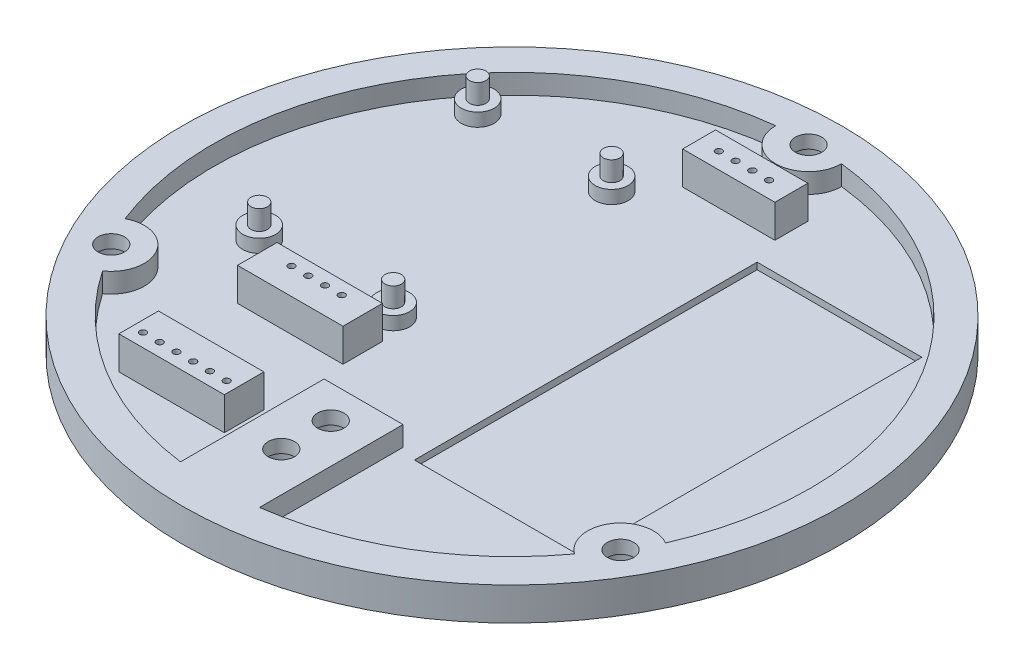
from build123d import *

# Parameters (mm, degrees)
SKIZZE2_R                        = 50
SKIZZE2_R_2                      = 2
AUFSATZ_LINEAR_AUSTRAGEN1_DEPTH  = 5
SCHNITT_LINEAR_AUSTRAGEN2_DEPTH  = 3
SKIZZE10_R                       = 3.5
SCHNITT_LINEAR_AUSTRAGEN3_DEPTH  = 3
SCHNITT_LINEAR_AUSTRAGEN7_DEPTH  = 3
SKIZZE27_W                       = 25
SKIZZE27_H                       = 52
SCHNITT_LINEAR_AUSTRAGEN10_DEPTH = 1
SKIZZE12_R                       = 2.5
AUFSATZ_LINEAR_AUSTRAGEN5_DEPTH  = 2
SKIZZE30_R                       = 1.25
AUFSATZ_LINEAR_AUSTRAGEN6_DEPTH  = 3
SKIZZE31_W                       = 16
SKIZZE31_H                       = 6
AUFSATZ_LINEAR_AUSTRAGEN8_DEPTH  = 5
SKIZZE32_R                       = 0.5
SCHNITT_LINEAR_AUSTRAGEN11_DEPTH = 6.5
SKIZZE35_W                       = 14
SKIZZE35_H                       = 5
AUFSATZ_LINEAR_AUSTRAGEN9_DEPTH  = 5
SKIZZE36_R                       = 0.5
SCHNITT_LINEAR_AUSTRAGEN12_DEPTH = 6.5


with BuildPart() as part:
    # Skizze2 → Aufsatz-Linear austragen1 (new body)
    with BuildSketch(Plane(origin=(0, 0, 0), x_dir=(1, 0, 0), z_dir=(0, 1, 0))):
        with Locations(Location((0, 0, 0), (0, 0, 270))):
            Circle(SKIZZE2_R)
        with Locations(Location((38.97114317, -22.5, 0), (0, 0, 270))):
            Circle(SKIZZE2_R_2, mode=Mode.SUBTRACT)
        with Locations(Location((-39.80150929, -20.996186754, 0), (0, 0, 270))):
            Circle(SKIZZE2_R_2, mode=Mode.SUBTRACT)
        with Locations(Location((0, 45, 0), (0, 0, 270))):
            Circle(SKIZZE2_R_2, mode=Mode.SUBTRACT)
        with Locations(Location((0, -35, 0), (0, 0, 270))):
            Circle(SKIZZE2_R_2, mode=Mode.SUBTRACT)
        with Locations(Location((0, -27.5, 0), (0, 0, 270))):
            Circle(SKIZZE2_R_2, mode=Mode.SUBTRACT)
    extrude(amount=AUFSATZ_LINEAR_AUSTRAGEN1_DEPTH)

    # Skizze9 → Schnitt-Linear austragen2 (cut)
    with BuildSketch(Plane(origin=(0, 5, 0), x_dir=(1, 0, 0), z_dir=(0, 1, 0))):
        with BuildLine():
            Line((-6, -39.531216002), (-6, -22.531216002))
            Line((-6, -22.531216002), (6, -22.531216002))
            Line((6, -22.531216002), (6, -39.531216002))
            ThreePointArc((6, -39.531216002), (0, 39.983959767), (-6, -39.531216002))
        make_face()
    extrude(amount=-SCHNITT_LINEAR_AUSTRAGEN2_DEPTH, mode=Mode.SUBTRACT)

    # Skizze10 → Schnitt-Linear austragen3 (cut)
    with BuildSketch(Plane.XZ):
        with Locations(Location((0, 27.5, 0), (0, 0, 270))):
            Circle(SKIZZE10_R)
        with Locations(Location((0, 35, 0), (0, 0, 270))):
            Circle(SKIZZE10_R)
        with Locations(Location((38.97114317, 22.5, 0), (0, 0, 270))):
            Circle(SKIZZE10_R)
        with Locations(Location((-39.80150929, 20.996186754, 0), (0, 0, 270))):
            Circle(SKIZZE10_R)
        with Locations(Location((0, -45, 0), (0, 0, 270))):
            Circle(SKIZZE10_R)
    extrude(amount=-SCHNITT_LINEAR_AUSTRAGEN3_DEPTH, mode=Mode.SUBTRACT)

    # Skizze11 → Schnitt-Linear austragen7 (cut)
    with BuildSketch(Plane(origin=(0, 5, 0), x_dir=(1, 0, 0), z_dir=(0, 1, 0))):
        with BuildLine():
            Line((-5.978957813, -44.319844294), (-5.978957813, -22.5))
            Line((-5.978957813, -22.5), (6, -22.531216002))
            Line((6, -22.531216002), (6, -44.317000516))
            ThreePointArc((6, -44.317000516), (22.808968791, -38.467485978), (36.005466779, -26.525514072))
            ThreePointArc((36.005466779, -26.525514072), (34.786839389, -19.762920925), (41.47114317, -18.169872981))
            ThreePointArc((41.47114317, -18.169872981), (39.210967853, 22.638462845), (5, 45))
            ThreePointArc((5, 45), (0, 40), (-5, 45))
            ThreePointArc((-5, 45), (-38.771722635, 23.382761255), (-42.13441893, -16.573796833))
            ThreePointArc((-42.13441893, -16.573796833), (-35.515787713, -18.42080512), (-36.991636347, -25.131959239))
            ThreePointArc((-36.991636347, -25.131959239), (-23.530017506, -38.030708788), (-5.978957813, -44.319844294))
        make_face()
    extrude(amount=-SCHNITT_LINEAR_AUSTRAGEN7_DEPTH, mode=Mode.SUBTRACT)

    # Skizze27 → Schnitt-Linear austragen10 (cut)
    with BuildSketch(Plane.XZ.offset(-2)):
        with Locations((21.020025154, -2.667993815)):
            Rectangle(SKIZZE27_W, SKIZZE27_H)
    extrude(amount=SCHNITT_LINEAR_AUSTRAGEN10_DEPTH, mode=Mode.SUBTRACT)

    # Skizze12 → Aufsatz-Linear austragen5 (add)
    with BuildSketch(Plane(origin=(0, 2, 0), x_dir=(1, 0, 0), z_dir=(0, 1, 0))):
        with Locations(Location((-32.155741969, 26.956104286, 0), (0, 0, 90))):
            Circle(SKIZZE12_R)
        with Locations(Location((-11.835741969, 26.956104286, 0), (0, 0, 90))):
            Circle(SKIZZE12_R)
        with Locations(Location((-32.155741969, -6.193895714, 0), (0, 0, 90))):
            Circle(SKIZZE12_R)
        with Locations(Location((-11.835741969, -6.193895714, 0), (0, 0, 90))):
            Circle(SKIZZE12_R)
    extrude(amount=AUFSATZ_LINEAR_AUSTRAGEN5_DEPTH)

    # Skizze30 → Aufsatz-Linear austragen6 (add)
    with BuildSketch(Plane(origin=(0, 4, 0), x_dir=(1, 0, 0), z_dir=(0, 1, 0))):
        with Locations(Location((-32.155741969, 26.956104286, 0), (0, 0, 270))):
            Circle(SKIZZE30_R)
        with Locations(Location((-11.835741969, 26.956104286, 0), (0, 0, 270))):
            Circle(SKIZZE30_R)
        with Locations(Location((-32.155741969, -6.193895714, 0), (0, 0, 270))):
            Circle(SKIZZE30_R)
        with Locations(Location((-11.835741969, -6.193895714, 0), (0, 0, 270))):
            Circle(SKIZZE30_R)
    extrude(amount=AUFSATZ_LINEAR_AUSTRAGEN6_DEPTH)

    # Skizze31 → Aufsatz-Linear austragen8 (add)
    with BuildSketch(Plane(origin=(0, 2, 0), x_dir=(1, 0, 0), z_dir=(0, 1, 0))):
        with Locations((-17.477480193, -13.166385762)):
            Rectangle(SKIZZE31_W, SKIZZE31_H)
        with Locations((-17.477480193, -31.166385762)):
            Rectangle(SKIZZE31_W, SKIZZE31_H)
    extrude(amount=AUFSATZ_LINEAR_AUSTRAGEN8_DEPTH)

    # Skizze32 → Schnitt-Linear austragen11 (cut)
    with BuildSketch(Plane(origin=(0, 7, 0), x_dir=(1, 0, 0), z_dir=(0, 1, 0))):
        with Locations(Location((-16.207480193, -12.166385762, 0), (0, 0, 270))):
            Circle(SKIZZE32_R)
        with Locations(Location((-13.667480193, -12.166385762, 0), (0, 0, 270))):
            Circle(SKIZZE32_R)
        with Locations(Location((-18.747480193, -12.166385762, 0), (0, 0, 270))):
            Circle(SKIZZE32_R)
        with Locations(Location((-21.287480193, -12.166385762, 0), (0, 0, 270))):
            Circle(SKIZZE32_R)
        with Locations(Location((-16.207480193, -32.166385762, 0), (0, 0, 270))):
            Circle(SKIZZE32_R)
        with Locations(Location((-13.667480193, -32.166385762, 0), (0, 0, 270))):
            Circle(SKIZZE32_R)
        with Locations(Location((-11.127480193, -32.166385762, 0), (0, 0, 270))):
            Circle(SKIZZE32_R)
        with Locations(Location((-18.747480193, -32.166385762, 0), (0, 0, 270))):
            Circle(SKIZZE32_R)
        with Locations(Location((-21.287480193, -32.166385762, 0), (0, 0, 270))):
            Circle(SKIZZE32_R)
        with Locations(Location((-23.827480193, -32.166385762, 0), (0, 0, 270))):
            Circle(SKIZZE32_R)
    extrude(amount=-SCHNITT_LINEAR_AUSTRAGEN11_DEPTH, mode=Mode.SUBTRACT)

    # Skizze35 → Aufsatz-Linear austragen9 (add)
    with BuildSketch(Plane(origin=(0, 2, 0), x_dir=(1, 0, 0), z_dir=(0, 1, 0))):
        with Locations((0, 35.385800952)):
            Rectangle(SKIZZE35_W, SKIZZE35_H)
    extrude(amount=AUFSATZ_LINEAR_AUSTRAGEN9_DEPTH)

    # Skizze36 → Schnitt-Linear austragen12 (cut)
    with BuildSketch(Plane(origin=(0, 7, 0), x_dir=(1, 0, 0), z_dir=(0, 1, 0))):
        with Locations(Location((1.118435078, 35.339246481, 0), (0, 0, 270))):
            Circle(SKIZZE36_R)
        with Locations(Location((3.658435078, 35.339246481, 0), (0, 0, 270))):
            Circle(SKIZZE36_R)
        with Locations(Location((-1.421564922, 35.339246481, 0), (0, 0, 270))):
            Circle(SKIZZE36_R)
        with Locations(Location((-3.961564922, 35.339246481, 0), (0, 0, 270))):
            Circle(SKIZZE36_R)
    extrude(amount=-SCHNITT_LINEAR_AUSTRAGEN12_DEPTH, mode=Mode.SUBTRACT)


solid = part.part
